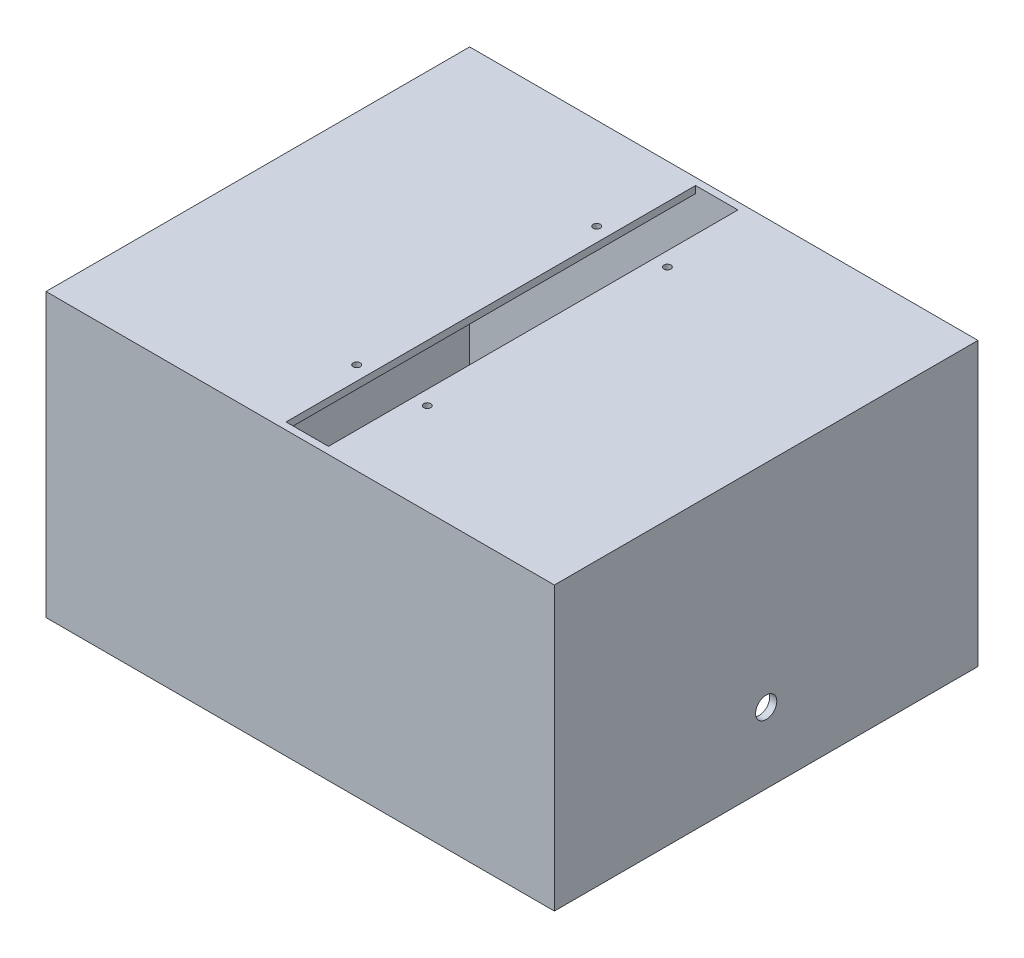
from build123d import *

# Parameters (mm, degrees)
SKETCH1_W           = 360
SKETCH1_H           = 300
BOSS_EXTRUDE1_DEPTH = 200
SKETCH2_W           = 350
SKETCH2_H           = 290
CUT_EXTRUDE1_DEPTH  = 195
SKETCH3_W           = 30
SKETCH3_H           = 290
CUT_EXTRUDE2_DEPTH  = 309.058436015
SKETCH4_R           = 7.5
CUT_EXTRUDE3_DEPTH  = 439.292140016
SKETCH5_R           = 2.5
CUT_EXTRUDE4_DEPTH  = 5


with BuildPart() as part:
    # Sketch1 → Boss-Extrude1 (new body)
    with BuildSketch(Plane(origin=(0, 0, 0), x_dir=(1, 0, 0), z_dir=(0, 1, 0))):
        Rectangle(SKETCH1_W, SKETCH1_H)
    extrude(amount=-BOSS_EXTRUDE1_DEPTH)

    # Sketch2 → Cut-Extrude1 (cut)
    with BuildSketch(Plane.XZ.offset(200)):
        Rectangle(SKETCH2_W, SKETCH2_H)
    extrude(amount=-CUT_EXTRUDE1_DEPTH, mode=Mode.SUBTRACT)

    # Sketch3 → Cut-Extrude2 (cut, through all)
    with BuildSketch(Plane(origin=(0, 0, 0), x_dir=(1, 0, 0), z_dir=(0, 1, 0))):
        Rectangle(SKETCH3_W, SKETCH3_H)
    extrude(amount=-CUT_EXTRUDE2_DEPTH, mode=Mode.SUBTRACT)

    # Sketch4 → Cut-Extrude3 (cut, through all)
    with BuildSketch(Plane.ZY.offset(180)):
        with Locations((0, -150)):
            Circle(SKETCH4_R)
    extrude(amount=-CUT_EXTRUDE3_DEPTH, mode=Mode.SUBTRACT)

    # Sketch5 → Cut-Extrude4 (cut)
    with BuildSketch(Plane(origin=(0, 0, 0), x_dir=(1, 0, 0), z_dir=(0, 1, 0))):
        with Locations(Location((-25, 85, 0), (0, 0, 270))):
            Circle(SKETCH5_R)
        with Locations(Location((25, 85, 0), (0, 0, 270))):
            Circle(SKETCH5_R)
        with Locations(Location((25, -85, 0), (0, 0, 270))):
            Circle(SKETCH5_R)
        with Locations(Location((-25, -85, 0), (0, 0, 270))):
            Circle(SKETCH5_R)
    extrude(amount=-CUT_EXTRUDE4_DEPTH, mode=Mode.SUBTRACT)


solid = part.part
